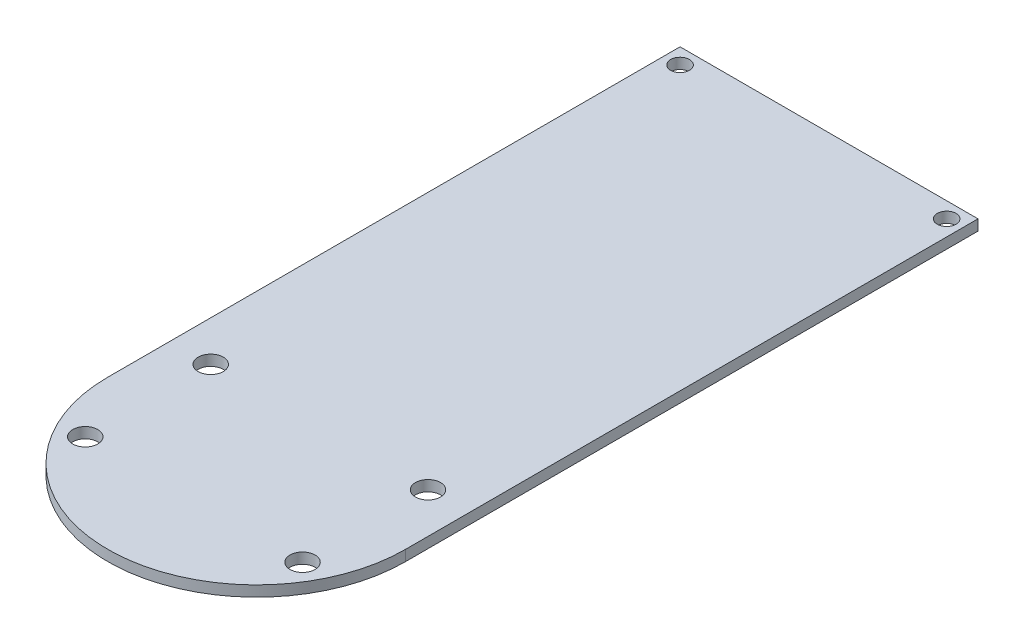
from build123d import *

# Parameters (mm, degrees)
ESBO_O1_R                = 1.5
ESBO_O1_R_2              = 2
RESSALTO_EXTRUS_O1_DEPTH = 1.7
ESBO_O2_W                = 4.3
ESBO_O2_H                = 5.17
RESSALTO_EXTRUS_O2_DEPTH = 0.9
CHANFRO1_SIZE            = 0.7


with BuildPart() as part:
    # Esboço1 → Ressalto-extrusão1 (new body)
    with BuildSketch(Plane(origin=(0, 0, 0), x_dir=(1, 0, 0), z_dir=(0, 1, 0))):
        with BuildLine():
            Line((-23.75, 45.625), (23.75, 45.625))
            Line((23.75, 45.625), (23.75, -45.625))
            ThreePointArc((23.75, -45.625), (0, -69.375), (-23.75, -45.625))
            Line((-23.75, -45.625), (-23.75, 45.625))
        make_face()
        with Locations(Location((-21.25, 43.125, 0), (0, 0, 270))):
            Circle(ESBO_O1_R, mode=Mode.SUBTRACT)
        with Locations(Location((21.25, 43.125, 0), (0, 0, 90))):
            Circle(ESBO_O1_R, mode=Mode.SUBTRACT)
        with Locations(Location((17.320508076, -35.625, 0), (0, 0, 270))):
            Circle(ESBO_O1_R_2, mode=Mode.SUBTRACT)
        with Locations(Location((17.320508076, -55.625, 0), (0, 0, 270))):
            Circle(ESBO_O1_R_2, mode=Mode.SUBTRACT)
        with Locations(Location((-17.320508076, -55.625, 0), (0, 0, 270))):
            Circle(ESBO_O1_R_2, mode=Mode.SUBTRACT)
        with Locations(Location((-17.320508076, -35.625, 0), (0, 0, 270))):
            Circle(ESBO_O1_R_2, mode=Mode.SUBTRACT)
    extrude(amount=RESSALTO_EXTRUS_O1_DEPTH)

    # Esboço2 → Ressalto-extrusão2 (add)
    with BuildSketch(Plane.XZ):
        with Locations((0, 46.25)):
            Rectangle(ESBO_O2_W, ESBO_O2_H)
    extrude(amount=RESSALTO_EXTRUS_O2_DEPTH)

    # Chanfro1
    chanfro1_edges = [part.edges().sort_by_distance(p)[0] for p in [
        (2.15, 0, 46.25),
        (-2.15, 0, 46.25),
    ]]
    chamfer(chanfro1_edges, length=CHANFRO1_SIZE)


solid = part.part
